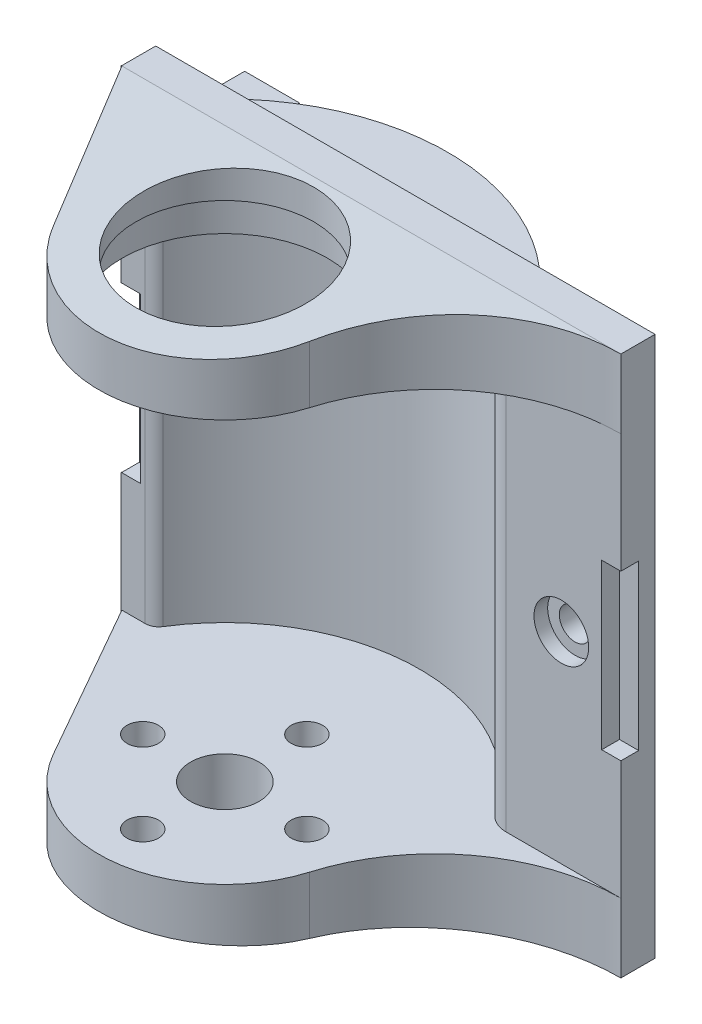
from build123d import *

# Parameters (mm, degrees)
SKETCH_1_R               = 16.3
EXTRUDE_1_DEPTH          = 19.75
SKETCH_2_W               = 36.5
SKETCH_2_H               = 2.5
EXTRUDE_2_DEPTH          = 39.5
SKETCH_3_W               = 44.844436064
SKETCH_3_H               = 25.506740045
CUT_EXTRUDE_1_DEPTH      = 50
EXTRUDE_3_DEPTH          = 5.05
SKETCH_5_R               = 14.25
CUT_EXTRUDE_2_DEPTH      = 29.4
SKETCH_6_R               = 2.5
CUT_EXTRUDE_3_DEPTH      = 44.930797853
CUT_EXTRUDE_6_REACH      = 49.993
SKETCH_9_R               = 7.5
SKETCH_12_R              = 1.15
CUT_EXTRUDE_9_DEPTH      = 34.662664779
SKETCH_13_R              = 2
CUT_EXTRUDE_10_DEPTH     = 1
SKETCH_14_W              = 2.8
SKETCH_14_H              = 12
CUT_EXTRUDE_11_DEPTH     = 1.3
SKETCH_15_W              = 2.8
SKETCH_15_H              = 12
CUT_EXTRUDE_12_DEPTH     = 1.3
EXTRUDE_5_REACH          = 40.183
EXTRUDE_5_END_RADIUS     = 16.3
SKETCH_16_W              = 4
SKETCH_16_H              = 5
SKETCH_17_W              = 1
SKETCH_17_H              = 2
CUT_EXTRUDE_13_DEPTH     = 2.5
SKETCH_19_R              = 8.51898124
SKETCH_19_R_2            = 6.5
EXTRUDE_6_DEPTH          = 2.25
CUT_EXTRUDE_18_REACH     = 49.993
SKETCH_20_R              = 1.15
PATTERN_CIRCULAR_1_COUNT = 4
CUT_EXTRUDE_8_DEPTH      = 45.587021654
SKETCH_18_W              = 26.346157216
SKETCH_18_H              = 2.75
CUT_EXTRUDE_16_DEPTH     = 12.5
FILLET_1_R               = 2
FILLET_2_R               = 1


with BuildPart() as part:
    # 草图1 → 凸台-拉伸1 (new, symmetric)
    with BuildSketch(Plane(origin=(0, 0, 0), x_dir=(1, 0, 0), z_dir=(0, 1, 0))):
        with Locations(Location((0, 0, 0), (0, 0, 270))):
            Circle(SKETCH_1_R)
    extrude(amount=EXTRUDE_1_DEPTH, both=True)

    # 草图2 → 凸台-拉伸2 (add, through all)
    with BuildSketch(Plane.XZ.offset(19.75)):
        with Locations((3.6, -8.35)):
            Rectangle(SKETCH_2_W, SKETCH_2_H)
    extrude(amount=-EXTRUDE_2_DEPTH)

    # 草图3 → 切除-拉伸1 (cut)
    with BuildSketch(Plane.XZ.offset(19.75)):
        with Locations((-0.572218032, 5.653370022)):
            Rectangle(SKETCH_3_W, SKETCH_3_H)
    extrude(amount=-CUT_EXTRUDE_1_DEPTH, mode=Mode.SUBTRACT)

    # 草图4 → 凸台-拉伸3 (add)
    with BuildSketch(Plane.XZ.offset(19.75)):
        with BuildLine():
            Line((-14.65, -7.146152811), (-7.996542478, 4.549209646))
            ThreePointArc((-7.996542478, 4.549209646), (1.047927533, 9.140122969), (8.818653972, 2.621324497))
            ThreePointArc((8.818653972, 2.621324497), (13.721037439, -4.401937543), (21.85, -7.1))
            Line((21.85, -7.1), (-14.65, -7.146152811))
        make_face()
    extrude_3 = extrude(amount=-EXTRUDE_3_DEPTH)

    # 镜向1: 凸台-拉伸3 across plane
    add(extrude_3.mirror(Plane.ZX))

    # 草图5 → 切除-拉伸2 (cut)
    with BuildSketch(Plane(origin=(0, -14.7, 0), x_dir=(1, 0, 0), z_dir=(0, 1, 0))):
        Circle(SKETCH_5_R)
    extrude(amount=CUT_EXTRUDE_2_DEPTH, mode=Mode.SUBTRACT)

    # 草图6 → 切除-拉伸3 (cut, through all)
    with BuildSketch(Plane(origin=(0, -14.7, 0), x_dir=(1, 0, 0), z_dir=(0, 1, 0))):
        with Locations(Location((0, 0, 0), (0, 0, 270))):
            Circle(SKETCH_6_R)
    extrude(amount=-CUT_EXTRUDE_3_DEPTH, mode=Mode.SUBTRACT)

    # 草图9 → 切除-拉伸6 (cut, up to next)
    with BuildSketch(Plane(origin=(0, 19.75, 0), x_dir=(1, 0, 0), z_dir=(0, 1, 0)), mode=Mode.PRIVATE) as cut_extrude_6_sk1:
        with Locations(Location((0, 0, 0), (0, 0, 270))):
            Circle(SKETCH_9_R)
    cut_extrude_6_tool1 = extrude(cut_extrude_6_sk1.sketch, amount=-CUT_EXTRUDE_6_REACH, mode=Mode.PRIVATE) & part.part
    add(cut_extrude_6_tool1.solids().sort_by_distance((0, 19.75, 0))[0], mode=Mode.SUBTRACT)

    # 草图12 → 切除-拉伸9 (cut, through all)
    with BuildSketch(Plane.XY.offset(-7.1)):
        with Locations((17.5, 0)):
            Circle(SKETCH_12_R)
    extrude(amount=-CUT_EXTRUDE_9_DEPTH, mode=Mode.SUBTRACT)

    # 草图13 → 切除-拉伸10 (cut)
    with BuildSketch(Plane.XY.offset(-7.1)):
        with Locations((17.5, 0)):
            Circle(SKETCH_13_R)
    extrude(amount=-CUT_EXTRUDE_10_DEPTH, mode=Mode.SUBTRACT)

    # 草图14 → 切除-拉伸11 (cut)
    with BuildSketch(Plane.XY.offset(-7.1)):
        with Locations((21.85, 0)):
            Rectangle(SKETCH_14_W, SKETCH_14_H)
    extrude(amount=-CUT_EXTRUDE_11_DEPTH, mode=Mode.SUBTRACT)

    # 草图15 → 切除-拉伸12 (cut)
    with BuildSketch(Plane.XY.offset(-7.1)):
        with Locations((-14.672423113, 0)):
            Rectangle(SKETCH_15_W, SKETCH_15_H)
    extrude(amount=-CUT_EXTRUDE_12_DEPTH, mode=Mode.SUBTRACT)

    # 凸台-拉伸5: up to this cylinder (the profile starts outside it)
    extrude_5_end = Plane(origin=(0, 13.4, 0), z_dir=(0, -1, 0)) * Cylinder(EXTRUDE_5_END_RADIUS, 113.966, mode=Mode.PRIVATE)
    # 草图16 → 凸台-拉伸5 (add, up to the surface)
    with BuildSketch(Plane(origin=(0, 0, -15.1), x_dir=(-1, 0, 0), z_dir=(0, 0, -1)), mode=Mode.PRIVATE) as extrude_5_sk1:
        with Locations((11.65, 13.4)):
            Rectangle(SKETCH_16_W, SKETCH_16_H)
    extrude_5_tool1 = extrude(extrude_5_sk1.sketch, amount=-EXTRUDE_5_REACH, mode=Mode.PRIVATE) - extrude_5_end
    extrude_5 = extrude_5_tool1.solids().sort_by_distance((-11.65, 13.4, -15.1))[0]
    add(extrude_5)

    # 镜向4: 凸台-拉伸5 across plane
    add(extrude_5.mirror(Plane.ZX))

    # 草图17 → 切除-拉伸13 (cut)
    with BuildSketch(Plane(origin=(0, 0, -15.1), x_dir=(-1, 0, 0), z_dir=(0, 0, -1))):
        with Locations((11.65, 13.4)):
            Rectangle(SKETCH_17_W, SKETCH_17_H)
    cut_extrude_13 = extrude(amount=-CUT_EXTRUDE_13_DEPTH, mode=Mode.SUBTRACT)

    # 镜向5: 切除-拉伸13 across plane
    add(cut_extrude_13.mirror(Plane.ZX), mode=Mode.SUBTRACT)

    # 草图19 → 凸台-拉伸6 (add)
    with BuildSketch(Plane(origin=(0, 19.75, 0), x_dir=(1, 0, 0), z_dir=(0, 1, 0))):
        Circle(SKETCH_19_R)
        with Locations(Location((0, 0, 0), (0, 0, 270))):
            Circle(SKETCH_19_R_2, mode=Mode.SUBTRACT)
    extrude(amount=-EXTRUDE_6_DEPTH)

    # 草图20 → 切除-拉伸18 (cut, up to next)
    with BuildSketch(Plane.XZ.offset(19.75), mode=Mode.PRIVATE) as cut_extrude_18_sk1:
        with Locations(Location((0, 6, 0), (0, 0, 270))):
            Circle(SKETCH_20_R)
    cut_extrude_18_tool1 = extrude(cut_extrude_18_sk1.sketch, amount=-CUT_EXTRUDE_18_REACH, mode=Mode.PRIVATE) & part.part
    cut_extrude_18 = cut_extrude_18_tool1.solids().sort_by_distance((0, -19.75, 6))[0]
    add(cut_extrude_18, mode=Mode.SUBTRACT)

    # 阵列(圆周)1: 切除-拉伸18 ×4 about axis
    pattern_circular_1_axis = Axis((0, 0, 0), (0, 1, 0))
    for i in range(1, PATTERN_CIRCULAR_1_COUNT):
        add(cut_extrude_18.rotate(pattern_circular_1_axis, i * 360 / PATTERN_CIRCULAR_1_COUNT), mode=Mode.SUBTRACT)

    # 草图7 → 切除-拉伸8 (cut, through all)
    with BuildSketch(Plane.ZY.offset(14.65)):
        Polygon((-7.1, 19.75), (9.2, 18.323934785), (9.2, 19.75), align=None)
    cut_extrude_8 = extrude(amount=-CUT_EXTRUDE_8_DEPTH, mode=Mode.SUBTRACT)

    # 镜向3: 切除-拉伸8 across plane
    add(cut_extrude_8.mirror(Plane.ZX), mode=Mode.SUBTRACT)

    # 草图18 → 切除-拉伸16 (cut)
    with BuildSketch(Plane(origin=(0, 0, -9.6), x_dir=(-1, 0, 0), z_dir=(0, 0, -1))):
        with Locations((0, 18.375)):
            Rectangle(SKETCH_18_W, SKETCH_18_H)
    cut_extrude_16 = extrude(amount=CUT_EXTRUDE_16_DEPTH, mode=Mode.SUBTRACT)

    # 镜向6: 切除-拉伸16 across plane
    add(cut_extrude_16.mirror(Plane.ZX), mode=Mode.SUBTRACT)

    # 圆角1
    fillet_1_edges = [part.edges().sort_by_distance(p)[0] for p in [
        (12.355262037, 0, -7.1),
    ]]
    fillet(fillet_1_edges, radius=FILLET_1_R)

    # 圆角2
    fillet_2_edges = [part.edges().sort_by_distance(p)[0] for p in [
        (-12.355262037, 0, -7.1),
    ]]
    fillet(fillet_2_edges, radius=FILLET_2_R)


solid = part.part
